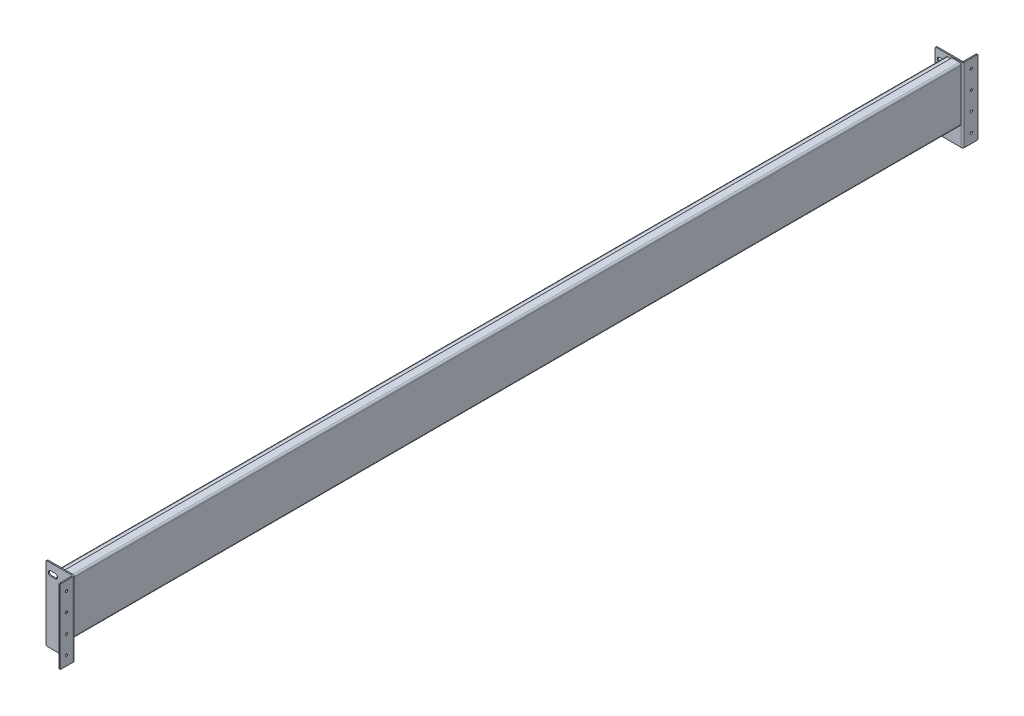
from build123d import *

# Parameters (mm, degrees)
BOSS_EXTRUDE1_DEPTH      = 1216.025
BOSS_EXTRUDE1_DEPTH_BACK = 1216.025
BOSS_EXTRUDE2_START      = -1216.025
BOSS_EXTRUDE2_DEPTH      = 2432.05
BOSS_EXTRUDE3_DEPTH      = 50.8
BOSS_EXTRUDE3_DEPTH_BACK = 152.4
SKETCH5_R                = 3.175
CUT_EXTRUDE1_DEPTH       = 1266.647753437
CUT_EXTRUDE2_DEPTH       = 3.175
CUT_EXTRUDE3_DEPTH       = 9.525
FILLET1_R                = 2.54


with BuildPart() as part:
    # Sketch1 → Boss-Extrude1 (new, two sides: drawn at the far end of the back side and taken through both)
    with BuildSketch(Plane.XY.offset(-BOSS_EXTRUDE1_DEPTH_BACK)):
        with BuildLine():
            Line((6.35, 71.4375), (26.9875, 71.4375))
            ThreePointArc((26.9875, 71.4375), (28.110032015, 70.972532015), (28.575, 69.85))
            Line((28.575, 69.85), (28.575, -69.85))
            ThreePointArc((28.575, -69.85), (28.110032015, -70.972532015), (26.9875, -71.4375))
            Line((26.9875, -71.4375), (-22.225, -71.4375))
            Line((-22.225, -71.4375), (-22.225, -74.6125))
            Line((-22.225, -74.6125), (26.9875, -74.6125))
            ThreePointArc((26.9875, -74.6125), (30.355096045, -73.217596045), (31.75, -69.85))
            Line((31.75, -69.85), (31.75, 69.85))
            ThreePointArc((31.75, 69.85), (30.355096045, 73.217596045), (26.9875, 74.6125))
            Line((26.9875, 74.6125), (6.35, 74.6125))
            Line((6.35, 74.6125), (6.35, 71.4375))
        make_face()
    extrude(amount=BOSS_EXTRUDE1_DEPTH + BOSS_EXTRUDE1_DEPTH_BACK)


with BuildPart() as body_2:
    # Sketch2 → Boss-Extrude2 (new body)
    with BuildSketch(Plane.XY.offset(BOSS_EXTRUDE2_START)):
        with BuildLine():
            Line((22.225, 71.4375), (-4.7625, 71.4375))
            ThreePointArc((-4.7625, 71.4375), (-8.130096045, 70.042596045), (-9.525, 66.675))
            Line((-9.525, 66.675), (-9.525, 38.1))
            ThreePointArc((-9.525, 38.1), (-10.919903955, 34.732403955), (-14.2875, 33.3375))
            Line((-14.2875, 33.3375), (-26.9875, 33.3375))
            ThreePointArc((-26.9875, 33.3375), (-30.355096045, 31.942596045), (-31.75, 28.575))
            Line((-31.75, 28.575), (-31.75, -66.675))
            ThreePointArc((-31.75, -66.675), (-30.355096045, -70.042596045), (-26.9875, -71.4375))
            Line((-26.9875, -71.4375), (22.225, -71.4375))
            Line((22.225, -71.4375), (22.225, -68.2625))
            Line((22.225, -68.2625), (-26.9875, -68.2625))
            ThreePointArc((-26.9875, -68.2625), (-28.110032015, -67.797532015), (-28.575, -66.675))
            Line((-28.575, -66.675), (-28.575, 28.575))
            ThreePointArc((-28.575, 28.575), (-28.110032015, 29.697532015), (-26.9875, 30.1625))
            Line((-26.9875, 30.1625), (-14.2875, 30.1625))
            ThreePointArc((-14.2875, 30.1625), (-8.674839924, 32.487339924), (-6.35, 38.1))
            Line((-6.35, 38.1), (-6.35, 66.675))
            ThreePointArc((-6.35, 66.675), (-5.885032015, 67.797532015), (-4.7625, 68.2625))
            Line((-4.7625, 68.2625), (22.225, 68.2625))
            Line((22.225, 68.2625), (22.225, 71.4375))
        make_face()
    extrude(amount=BOSS_EXTRUDE2_DEPTH)


with BuildPart() as body_3:
    # Sketch4 → Boss-Extrude3 (new, two sides: drawn at the far end of the back side and taken through both)
    with BuildSketch(Plane.XZ.offset(74.6125).offset(-BOSS_EXTRUDE3_DEPTH_BACK)):
        with BuildLine():
            Line((-39.6875, 1216.025), (31.75, 1216.025))
            ThreePointArc((31.75, 1216.025), (35.117596045, 1217.419903955), (36.5125, 1220.7875))
            Line((36.5125, 1220.7875), (36.5125, 1257.3))
            Line((36.5125, 1257.3), (33.3375, 1257.3))
            Line((33.3375, 1257.3), (33.3375, 1220.7875))
            ThreePointArc((33.3375, 1220.7875), (32.872532015, 1219.664967985), (31.75, 1219.2))
            Line((31.75, 1219.2), (-39.6875, 1219.2))
            Line((-39.6875, 1219.2), (-39.6875, 1216.025))
        make_face()
    extrude(amount=BOSS_EXTRUDE3_DEPTH + BOSS_EXTRUDE3_DEPTH_BACK)

    # Sketch5 → Cut-Extrude1 (cut, through all)
    with BuildSketch(Plane(origin=(33.3375, 0, 0), x_dir=(0, 0, -1), z_dir=(1, 0, 0))):
        with Locations((-1239.04502, 52.3875)):
            Circle(SKETCH5_R)
        with Locations((-1239.04502, 1.5875)):
            Circle(SKETCH5_R)
        with Locations((-1239.04502, -49.2125)):
            Circle(SKETCH5_R)
        with Locations((-1239.04502, -100.0125)):
            Circle(SKETCH5_R)
    extrude(amount=CUT_EXTRUDE1_DEPTH, mode=Mode.SUBTRACT)

    # Sketch9 → Cut-Extrude2 (cut)
    with BuildSketch(Plane(origin=(0, 0, 1216.025), x_dir=(-1, 0, 0), z_dir=(0, 0, -1))):
        with BuildLine():
            Line((14.2875, 58.7375), (26.9875, 58.7375))
            ThreePointArc((26.9875, 58.7375), (33.3375, 52.3875), (26.9875, 46.0375))
            Line((26.9875, 46.0375), (14.2875, 46.0375))
            ThreePointArc((14.2875, 46.0375), (7.9375, 52.3875), (14.2875, 58.7375))
        make_face()
    extrude(amount=-CUT_EXTRUDE2_DEPTH, mode=Mode.SUBTRACT)

    # Fillet1
    fillet1_edges = [body_3.edges().sort_by_distance(p)[0] for p in [
        (34.925, 77.7875, 1257.3),
        (-39.6875, -125.4125, 1217.6125),
        (34.925, -125.4125, 1257.3),
        (-39.6875, 77.7875, 1217.6125),
    ]]
    fillet(fillet1_edges, radius=FILLET1_R)


with BuildPart() as cut_extrude3_tool:
    # Sketch10 → Cut-Extrude3 (new body)
    with BuildSketch(Plane.XZ.offset(74.6125)):
        with BuildLine():
            Line((10.31875, 1192.2125), (-5.55625, 1192.2125))
            ThreePointArc((-5.55625, 1192.2125), (-10.31875, 1196.975), (-5.55625, 1201.7375))
            Line((-5.55625, 1201.7375), (10.31875, 1201.7375))
            ThreePointArc((10.31875, 1201.7375), (15.08125, 1196.975), (10.31875, 1192.2125))
        make_face()
    cut_extrude3 = extrude(amount=-CUT_EXTRUDE3_DEPTH)


with BuildPart() as part_1:
    add(part.part)

    # Cut-Extrude3: cut by cut_extrude3_tool
    add(cut_extrude3_tool.part, mode=Mode.SUBTRACT)


with BuildPart() as body_2_1:
    add(body_2.part)

    # Cut-Extrude3: cut by cut_extrude3_tool
    add(cut_extrude3_tool.part, mode=Mode.SUBTRACT)


with BuildPart() as mirror2_tool:
    # Mirror2: Cut-Extrude3 across plane
    add(cut_extrude3.mirror(Plane.XY))


with BuildPart() as part_2:
    add(part_1.part)

    # Mirror2: cut by mirror2_tool
    add(mirror2_tool.part, mode=Mode.SUBTRACT)


with BuildPart() as body_2_2:
    add(body_2_1.part)

    # Mirror2: cut by mirror2_tool
    add(mirror2_tool.part, mode=Mode.SUBTRACT)


with BuildPart() as body_4:
    # Mirror3: mirrored copy
    add(body_3.part.mirror(Plane.XY))


solid = Compound([body_3.part, part_2.part, body_2_2.part, body_4.part])
